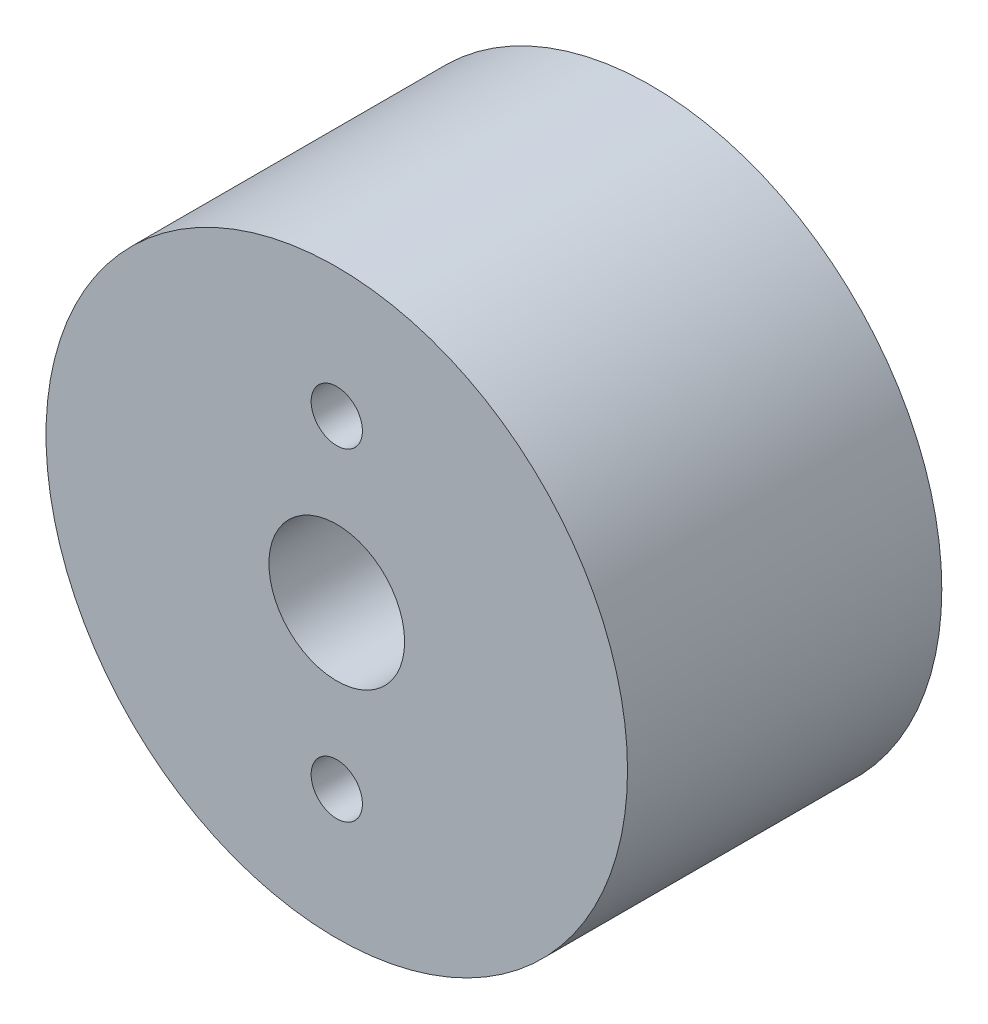
from build123d import *

# Parameters (mm, degrees)
SKETCH1_R           = 18
SKETCH1_R_2         = 1.5875
SKETCH1_R_3         = 4.2
BOSS_EXTRUDE2_DEPTH = 19.4564


with BuildPart() as part:
    # Sketch1 → Boss-Extrude2 (new body)
    with BuildSketch(Plane.XY):
        Circle(SKETCH1_R)
        with Locations((0, 10)):
            Circle(SKETCH1_R_2, mode=Mode.SUBTRACT)
        Circle(SKETCH1_R_3, mode=Mode.SUBTRACT)
        with Locations((0, -10)):
            Circle(SKETCH1_R_2, mode=Mode.SUBTRACT)
    extrude(amount=BOSS_EXTRUDE2_DEPTH)


solid = part.part
